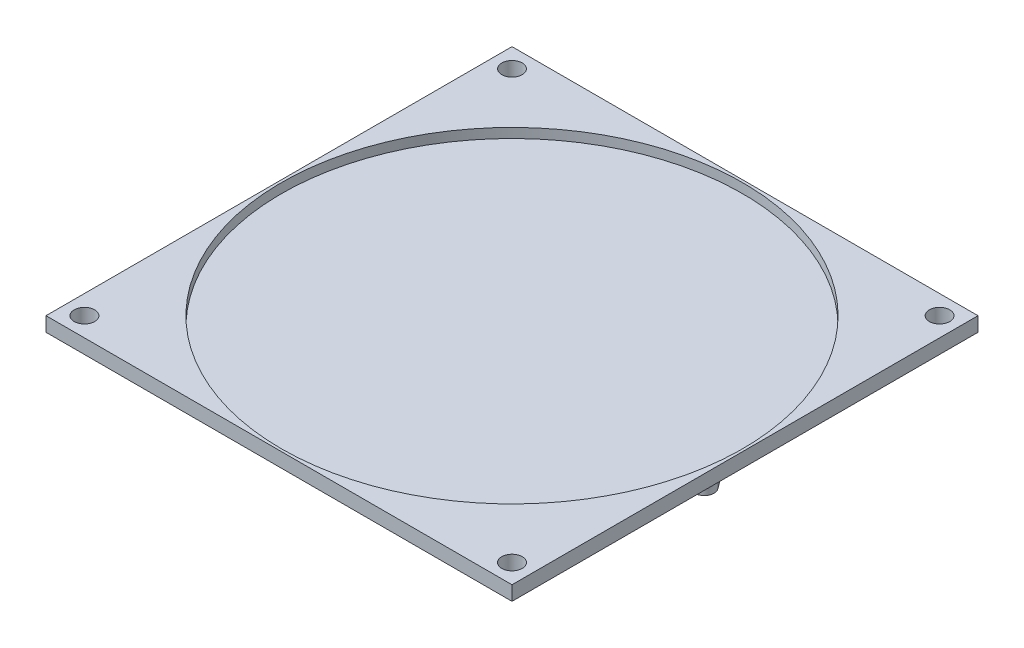
from build123d import *

# Parameters (mm, degrees)
SKETCH2_W           = 154.0002
SKETCH2_H           = 154.0002
BOSS_EXTRUDE1_DEPTH = 4.7625
SKETCH4_R           = 76.2
CUT_EXTRUDE1_DEPTH  = 3.175
SKETCH5_R           = 3.3782
CUT_EXTRUDE2_DEPTH  = 218.841237158
BOSS_EXTRUDE2_DEPTH = 3.175


with BuildPart() as part:
    # Sketch2 → Boss-Extrude1 (new body)
    with BuildSketch(Plane(origin=(0, 0, 0), x_dir=(1, 0, 0), z_dir=(0, 1, 0))):
        with Locations((77.0001, 77.0001)):
            Rectangle(SKETCH2_W, SKETCH2_H)
    extrude(amount=BOSS_EXTRUDE1_DEPTH)

    # Sketch4 → Cut-Extrude1 (cut)
    with BuildSketch(Plane(origin=(0, 4.7625, 0), x_dir=(1, 0, 0), z_dir=(0, 1, 0))):
        with Locations(Location((77.0001, 77.0001, 0), (0, 0, 270))):
            Circle(SKETCH4_R)
    extrude(amount=-CUT_EXTRUDE1_DEPTH, mode=Mode.SUBTRACT)

    # Sketch5 → Cut-Extrude2 (cut, through all)
    with BuildSketch(Plane(origin=(0, 4.7625, 0), x_dir=(1, 0, 0), z_dir=(0, 1, 0))):
        with Locations(Location((6.35, 6.35, 0), (0, 0, 270))):
            Circle(SKETCH5_R)
        with Locations(Location((6.35, 147.6502, 0), (0, 0, 270))):
            Circle(SKETCH5_R)
        with Locations(Location((147.6502, 147.6502, 0), (0, 0, 270))):
            Circle(SKETCH5_R)
        with Locations(Location((147.6502, 6.35, 0), (0, 0, 270))):
            Circle(SKETCH5_R)
    extrude(amount=-CUT_EXTRUDE2_DEPTH, mode=Mode.SUBTRACT)

    # Sketch7 → Boss-Extrude2 (add)
    with BuildSketch(Plane.XZ):
        with BuildLine():
            Line((109.284213593, -89.700088814), (123.348971479, -89.700088814))
            ThreePointArc((123.348971479, -89.700088814), (125.59403551, -88.770152844), (126.523971479, -86.525088814))
            Line((126.523971479, -86.525088814), (126.523971479, -67.475088814))
            ThreePointArc((126.523971479, -67.475088814), (124.341654203, -64.459262889), (120.794707851, -65.589256818))
            Line((120.794707851, -65.589256818), (106.729949965, -84.639256818))
            ThreePointArc((106.729949965, -84.639256818), (106.449769946, -87.955667091), (109.284213593, -89.700088814))
        make_face()
        with BuildLine():
            Line((150.113729365, -64.300088814), (136.048971479, -64.300088814))
            ThreePointArc((136.048971479, -64.300088814), (133.803907449, -65.230024784), (132.873971479, -67.475088814))
            Line((132.873971479, -67.475088814), (132.873971479, -86.525088814))
            ThreePointArc((132.873971479, -86.525088814), (135.056288756, -89.540914739), (138.603235108, -88.410920809))
            Line((138.603235108, -88.410920809), (152.667992994, -69.360920809))
            ThreePointArc((152.667992994, -69.360920809), (152.948173013, -66.044510537), (150.113729365, -64.300088814))
        make_face()
        with BuildLine():
            Line((96.052127079, -88.410920809), (110.116884965, -69.360920809))
            ThreePointArc((110.116884965, -69.360920809), (110.397064984, -66.044510537), (107.562621336, -64.300088814))
            Line((107.562621336, -64.300088814), (93.49786345, -64.300088814))
            ThreePointArc((93.49786345, -64.300088814), (90.748232793, -65.887588814), (90.748232793, -69.062588814))
            ThreePointArc((90.748232793, -69.062588814), (92.875079508, -77.000088814), (90.748232793, -84.937588814))
            ThreePointArc((90.748232793, -84.937588814), (91.758452384, -89.181227768), (96.052127079, -88.410920809))
        make_face()
        with BuildLine():
            Line((25.251556253, -88.788587501), (44.618320403, -69.738587501))
            ThreePointArc((44.618320403, -69.738587501), (45.330145322, -66.272172219), (42.391843659, -64.300088814))
            Line((42.391843659, -64.300088814), (23.025079508, -64.300088814))
            ThreePointArc((23.025079508, -64.300088814), (20.780015478, -65.230024784), (19.850079508, -67.475088814))
            Line((19.850079508, -67.475088814), (19.850079508, -86.525088814))
            ThreePointArc((19.850079508, -86.525088814), (21.797976958, -89.453372327), (25.251556253, -88.788587501))
        make_face()
        with BuildLine():
            Line((58.275818822, -65.211590127), (38.909054672, -84.261590127))
            ThreePointArc((38.909054672, -84.261590127), (38.197229752, -87.728005409), (41.135531416, -89.700088814))
            Line((41.135531416, -89.700088814), (60.502295566, -89.700088814))
            ThreePointArc((60.502295566, -89.700088814), (63.251926223, -88.112588814), (63.251926223, -84.937588814))
            ThreePointArc((63.251926223, -84.937588814), (61.125079508, -77.000088814), (63.251926223, -69.062588814))
            ThreePointArc((63.251926223, -69.062588814), (62.445481153, -64.964181652), (58.275818822, -65.211590127))
        make_face()
    extrude(amount=BOSS_EXTRUDE2_DEPTH)


solid = part.part
